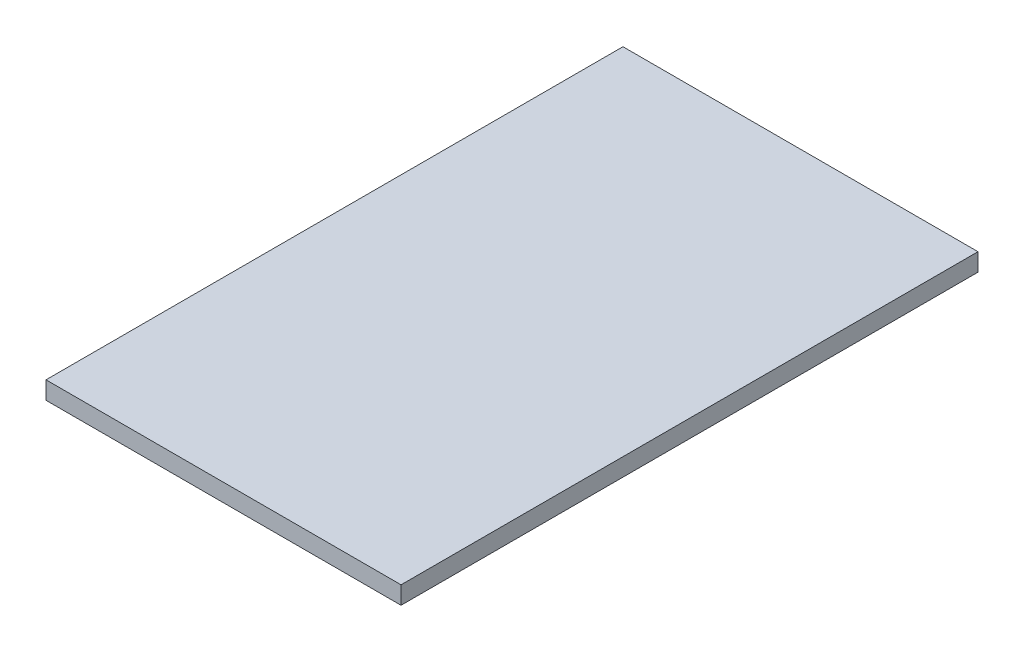
from build123d import *

# Parameters (mm, degrees)
SKETCH1_W           = 40.64
SKETCH1_H           = 66.04
BOSS_EXTRUDE1_DEPTH = 2.032


with BuildPart() as part:
    # Sketch1 → Boss-Extrude1 (new body)
    with BuildSketch(Plane(origin=(0, 0, 0), x_dir=(1, 0, 0), z_dir=(0, 1, 0))):
        with Locations((-9.467272727, 16.625454545)):
            Rectangle(SKETCH1_W, SKETCH1_H)
    extrude(amount=BOSS_EXTRUDE1_DEPTH)


solid = part.part
